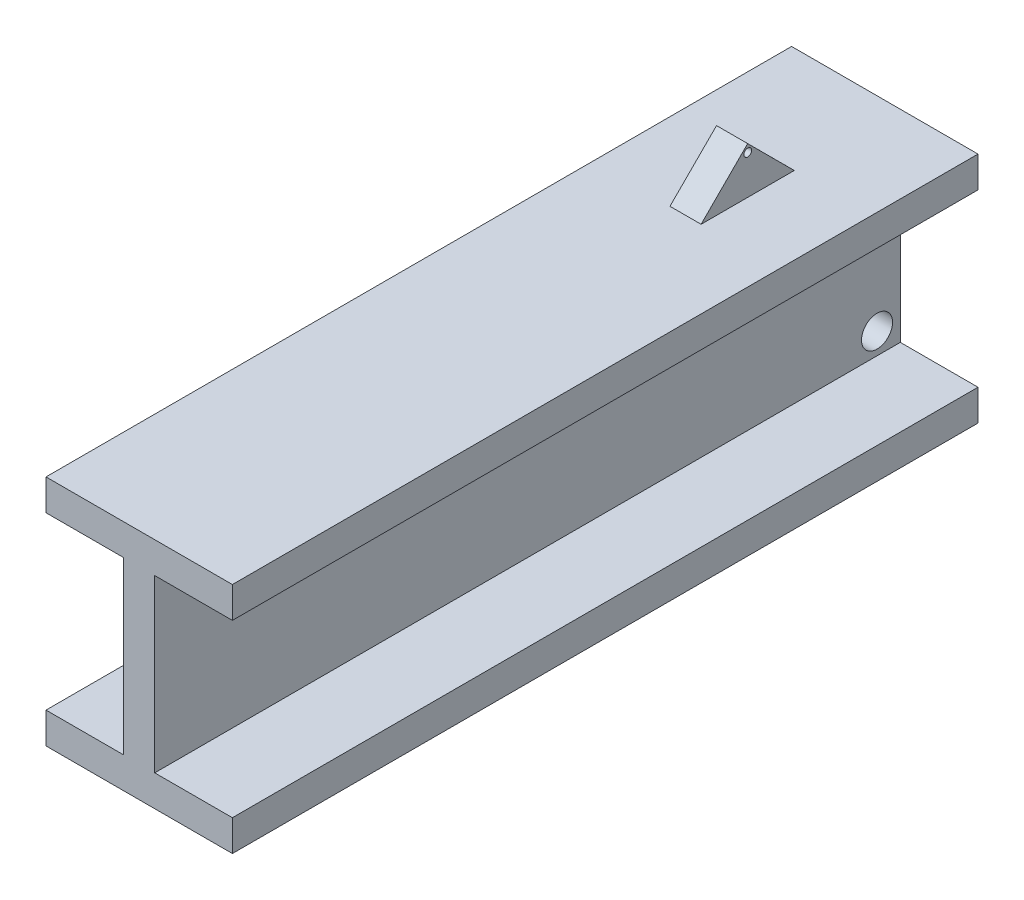
from build123d import *

# Parameters (mm, degrees)
BOSS_EXTRUDE1_DEPTH      = 1219.2
BOSS_EXTRUDE2_DEPTH      = 0.072177487
BOSS_EXTRUDE2_DEPTH_BACK = 50.872177487
BOSS_EXTRUDE3_DEPTH      = 0.072177487
BOSS_EXTRUDE3_DEPTH_BACK = 50.872177487
CUT_EXTRUDE1_DEPTH       = 101.6
CUT_EXTRUDE1_DEPTH_BACK  = 101.6
CUT_EXTRUDE3_DEPTH       = 76.2
CUT_EXTRUDE3_DEPTH_BACK  = 76.2
SKETCH7_R                = 6.35


with BuildPart() as part:
    # Sketch1 → Boss-Extrude1 (new body)
    with BuildSketch(Plane.XY):
        Polygon((152.4, 190.5), (-152.4, 190.5), (-152.4, 139.7), (-25.4, 139.7), (-25.4, -139.7), (-152.4, -139.7), (-152.4, -190.5), (152.4, -190.5), (152.4, -139.7), (25.4, -139.7), (25.4, 139.7), (152.4, 139.7), align=None)
    extrude(amount=BOSS_EXTRUDE1_DEPTH)

    # Sketch3 → Boss-Extrude2 (add, two sides: drawn at the far end of the back side and taken through both)
    with BuildSketch(Plane(origin=(25.4, 0, 0), x_dir=(0, 0, -1), z_dir=(1, 0, 0)).offset(-BOSS_EXTRUDE2_DEPTH_BACK)):
        Polygon((-325.848703736, 190.5), (-249.681440183, 190.5), (-249.681440183, 266.7), align=None)
        Polygon((-249.681440183, 266.7), (-249.681440183, 190.5), (-173.448689666, 190.5), align=None)
    extrude(amount=BOSS_EXTRUDE2_DEPTH + BOSS_EXTRUDE2_DEPTH_BACK)

    # Sketch4 → Boss-Extrude3 (add, two sides: drawn at the far end of the back side and taken through both)
    with BuildSketch(Plane(origin=(25.4, 0, 0), x_dir=(0, 0, -1), z_dir=(1, 0, 0)).offset(-BOSS_EXTRUDE3_DEPTH_BACK)):
        Polygon((-859.248696701, -266.7), (-859.248696701, -190.5), (-934.329981547, -190.5), align=None)
        Polygon((-781.913312631, -190.5), (-859.248696701, -190.5), (-859.248696701, -266.7), align=None)
    extrude(amount=BOSS_EXTRUDE3_DEPTH + BOSS_EXTRUDE3_DEPTH_BACK)

    # Sketch6 → Cut-Extrude1 (cut, two sides: drawn at the far end of the back side and taken through both)
    with BuildSketch(Plane(origin=(25.4, 0, 0), x_dir=(0, 0, -1), z_dir=(1, 0, 0)).offset(-CUT_EXTRUDE1_DEPTH_BACK)):
        with BuildLine():
            ThreePointArc((-38.1, 79.375), (-20.139487758, 86.814487758), (-12.7, 104.775))
            Line((-12.7, 104.775), (-38.1, 104.775))
            Line((-38.1, 104.775), (-38.1, 79.375))
        make_face()
        with BuildLine():
            Line((-38.1, 104.775), (-12.7, 104.775))
            ThreePointArc((-12.7, 104.775), (-56.060512242, 122.735512242), (-38.1, 79.375))
            Line((-38.1, 79.375), (-38.1, 104.775))
        make_face()
        with BuildLine():
            Line((-38.1, -130.175), (-38.1, -104.775))
            Line((-38.1, -104.775), (-38.1, -79.375))
            ThreePointArc((-38.1, -79.375), (-63.5, -104.775), (-38.1, -130.175))
        make_face()
        with BuildLine():
            ThreePointArc((-38.1, -130.175), (-20.139487758, -122.735512242), (-12.7, -104.775))
            Line((-12.7, -104.775), (-38.1, -104.775))
            Line((-38.1, -104.775), (-38.1, -130.175))
        make_face()
        with BuildLine():
            Line((-38.1, -104.775), (-12.7, -104.775))
            ThreePointArc((-12.7, -104.775), (-20.139487758, -86.814487758), (-38.1, -79.375))
            Line((-38.1, -79.375), (-38.1, -104.775))
        make_face()
    extrude(amount=CUT_EXTRUDE1_DEPTH + CUT_EXTRUDE1_DEPTH_BACK, mode=Mode.SUBTRACT)

    # Sketch7 → Cut-Extrude3 (cut, two sides: drawn at the far end of the back side and taken through both)
    with BuildSketch(Plane(origin=(25.472177487, 0, 0), x_dir=(0, 0, -1), z_dir=(1, 0, 0)).offset(-CUT_EXTRUDE3_DEPTH_BACK)):
        with Locations(Location((-249.681440183, 254, 0), (0, 0, 180))):
            Circle(SKETCH7_R)
        with Locations(Location((-859.248696701, -254, 0), (0, 0, 180))):
            Circle(SKETCH7_R)
    extrude(amount=CUT_EXTRUDE3_DEPTH + CUT_EXTRUDE3_DEPTH_BACK, mode=Mode.SUBTRACT)


solid = part.part
